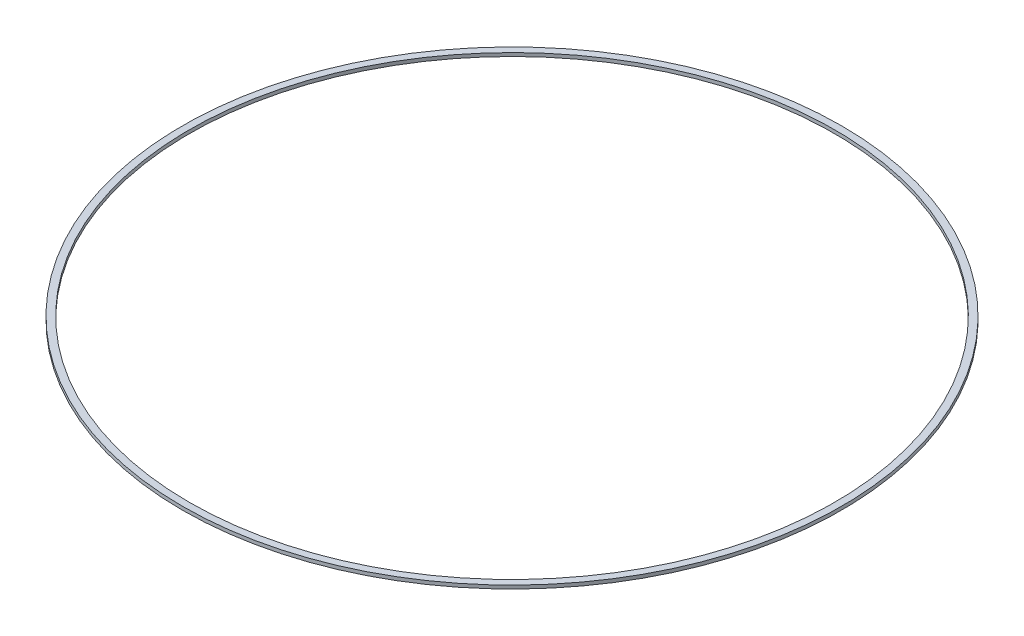
from build123d import *

# Parameters (mm, degrees)
SKETCH1_R           = 192
SKETCH1_R_2         = 190
SKETCH1_R_3         = 188
BOSS_EXTRUDE1_DEPTH = 2


with BuildPart() as part:
    # Sketch1 → Boss-Extrude1 (new body)
    # profile 1 of 2: a face of its own
    with BuildSketch(Plane(origin=(0, 0, 0), x_dir=(1, 0, 0), z_dir=(0, 1, 0))):
        with Locations(Location((-3.221569265, 4.602241807, 0), (0, 0, 270))):
            Circle(SKETCH1_R)
        with Locations((-3.221569265, 4.602241807)):
            Circle(SKETCH1_R_2, mode=Mode.SUBTRACT)
    # profile 2 of 2: a face of its own
    with BuildSketch(Plane(origin=(0, 0, 0), x_dir=(1, 0, 0), z_dir=(0, 1, 0))):
        with Locations((-3.221569265, 4.602241807)):
            Circle(SKETCH1_R_2)
        with Locations(Location((-3.221569265, 4.602241807, 0), (0, 0, 270))):
            Circle(SKETCH1_R_3, mode=Mode.SUBTRACT)
    extrude(amount=BOSS_EXTRUDE1_DEPTH)


solid = part.part
